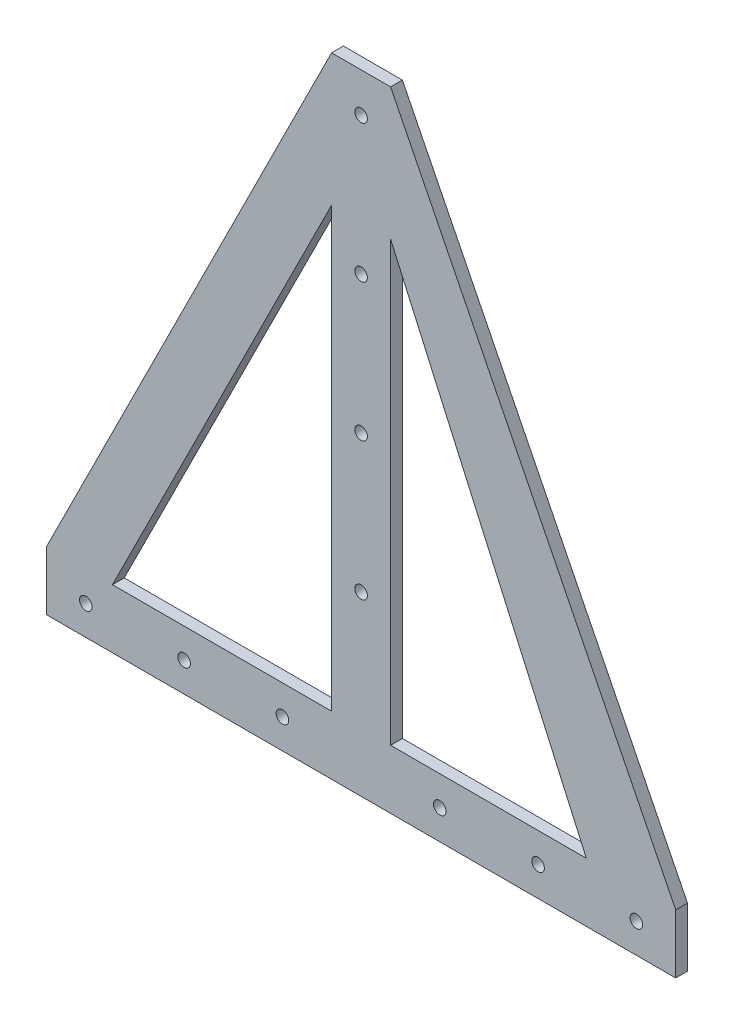
from build123d import *

# Parameters (mm, degrees)
SKETCH1_R           = 1.6
BOSS_EXTRUDE1_DEPTH = 3


with BuildPart() as part:
    # Sketch1 → Boss-Extrude1 (new body)
    with BuildSketch(Plane.XY):
        Polygon((0, 15), (72.5, 160), (87.5, 160), (160, 15), (160, 0), (0, 0), align=None)
        with Locations((150, 7.5)):
            Circle(SKETCH1_R, mode=Mode.SUBTRACT)
        with Locations((125, 7.5)):
            Circle(SKETCH1_R, mode=Mode.SUBTRACT)
        with Locations((100, 7.5)):
            Circle(SKETCH1_R, mode=Mode.SUBTRACT)
        with Locations(Location((10, 7.5, 0), (0, 0, 180))):
            Circle(SKETCH1_R, mode=Mode.SUBTRACT)
        with Locations(Location((35, 7.5, 0), (0, 0, 180))):
            Circle(SKETCH1_R, mode=Mode.SUBTRACT)
        with Locations(Location((60, 7.5, 0), (0, 0, 180))):
            Circle(SKETCH1_R, mode=Mode.SUBTRACT)
        with Locations((80, 150)):
            Circle(SKETCH1_R, mode=Mode.SUBTRACT)
        with Locations((80, 115)):
            Circle(SKETCH1_R, mode=Mode.SUBTRACT)
        with Locations((80, 80)):
            Circle(SKETCH1_R, mode=Mode.SUBTRACT)
        with Locations((80, 45)):
            Circle(SKETCH1_R, mode=Mode.SUBTRACT)
        Polygon((72.5, 126.458980338), (72.5, 15), (16.770509831, 15), align=None, mode=Mode.SUBTRACT)
        Polygon((87.5, 15), (137.271498835, 15), (87.5, 126.458980338), align=None, mode=Mode.SUBTRACT)
    extrude(amount=BOSS_EXTRUDE1_DEPTH)


solid = part.part
